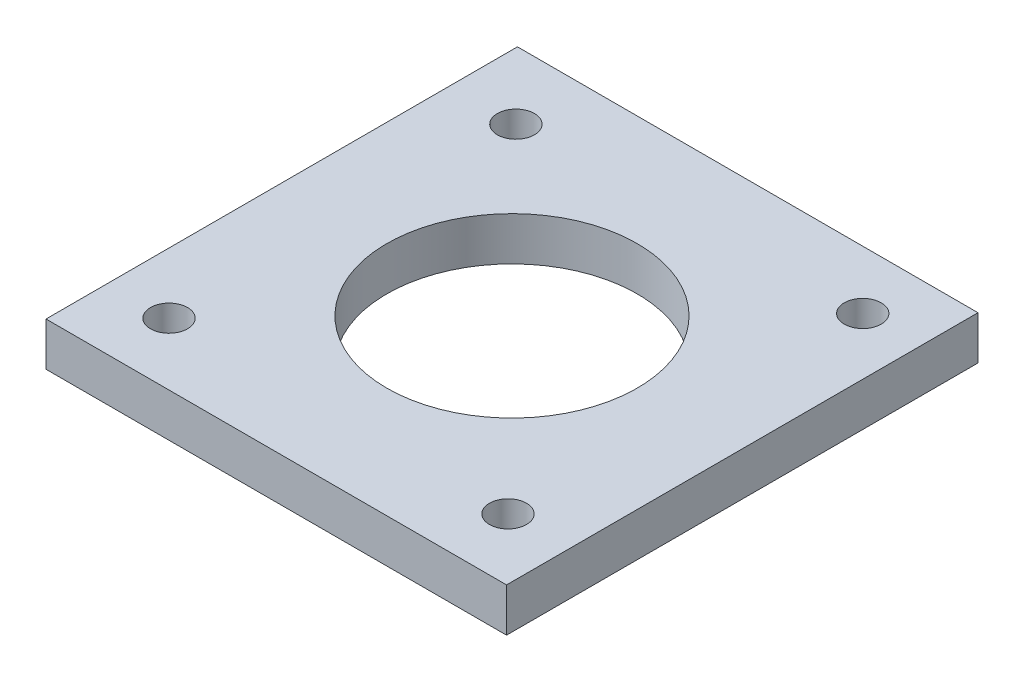
from build123d import *

# Parameters (mm, degrees)
SKETCH2_W           = 42.3
SKETCH2_H           = 43.3
SKETCH2_R           = 1.7
SKETCH2_R_2         = 11.5
BOSS_EXTRUDE1_DEPTH = 4


with BuildPart() as part:
    # Sketch2 → Boss-Extrude1 (new body)
    with BuildSketch(Plane(origin=(0, 0, 0), x_dir=(1, 0, 0), z_dir=(0, 1, 0))):
        Rectangle(SKETCH2_W, SKETCH2_H)
        with Locations(Location((-15.069374363, 15.425624348, 0), (0, 0, 270))):
            Circle(SKETCH2_R, mode=Mode.SUBTRACT)
        with Locations(Location((15.918439372, 16.294761816, 0), (0, 0, 270))):
            Circle(SKETCH2_R, mode=Mode.SUBTRACT)
        with Locations(Location((15.566385671, -15.934385332, 0), (0, 0, 270))):
            Circle(SKETCH2_R, mode=Mode.SUBTRACT)
        with Locations(Location((-15.566385671, -15.934385332, 0), (0, 0, 270))):
            Circle(SKETCH2_R, mode=Mode.SUBTRACT)
        with Locations(Location((0, 0, 0), (0, 0, 270))):
            Circle(SKETCH2_R_2, mode=Mode.SUBTRACT)
    extrude(amount=BOSS_EXTRUDE1_DEPTH)


solid = part.part
